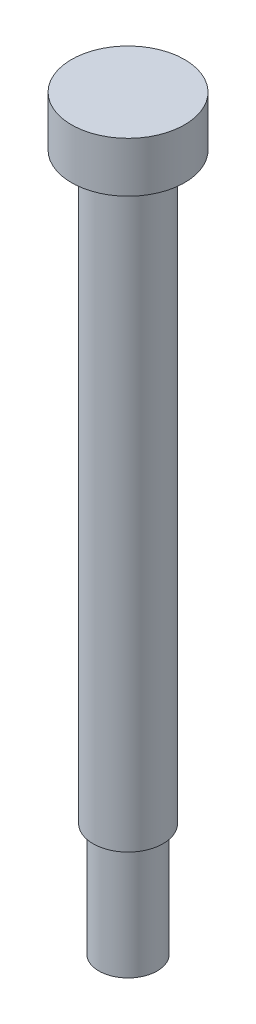
from build123d import *

# Parameters (mm, degrees)
SKETCH_1_R      = 4.85
EXTRUDE_1_DEPTH = 4.3
SKETCH_2_R      = 3
EXTRUDE_2_DEPTH = 50
SKETCH_3_R      = 2.5
EXTRUDE_3_DEPTH = 9.7


with BuildPart() as part:
    # 草图1 → 凸台-拉伸1 (new body)
    with BuildSketch(Plane(origin=(0, 0, 0), x_dir=(1, 0, 0), z_dir=(0, 1, 0))):
        with Locations(Location((0, 0, 0), (0, 0, 90))):
            Circle(SKETCH_1_R)
    extrude(amount=EXTRUDE_1_DEPTH)

    # 草图2 → 凸台-拉伸2 (add)
    with BuildSketch(Plane.XZ):
        with Locations(Location((0, 0, 0), (0, 0, 270))):
            Circle(SKETCH_2_R)
    extrude(amount=EXTRUDE_2_DEPTH)

    # 草图3 → 凸台-拉伸3 (add)
    with BuildSketch(Plane.XZ.offset(50)):
        with Locations(Location((0, 0, 0), (0, 0, 270))):
            Circle(SKETCH_3_R)
    extrude(amount=EXTRUDE_3_DEPTH)


solid = part.part
